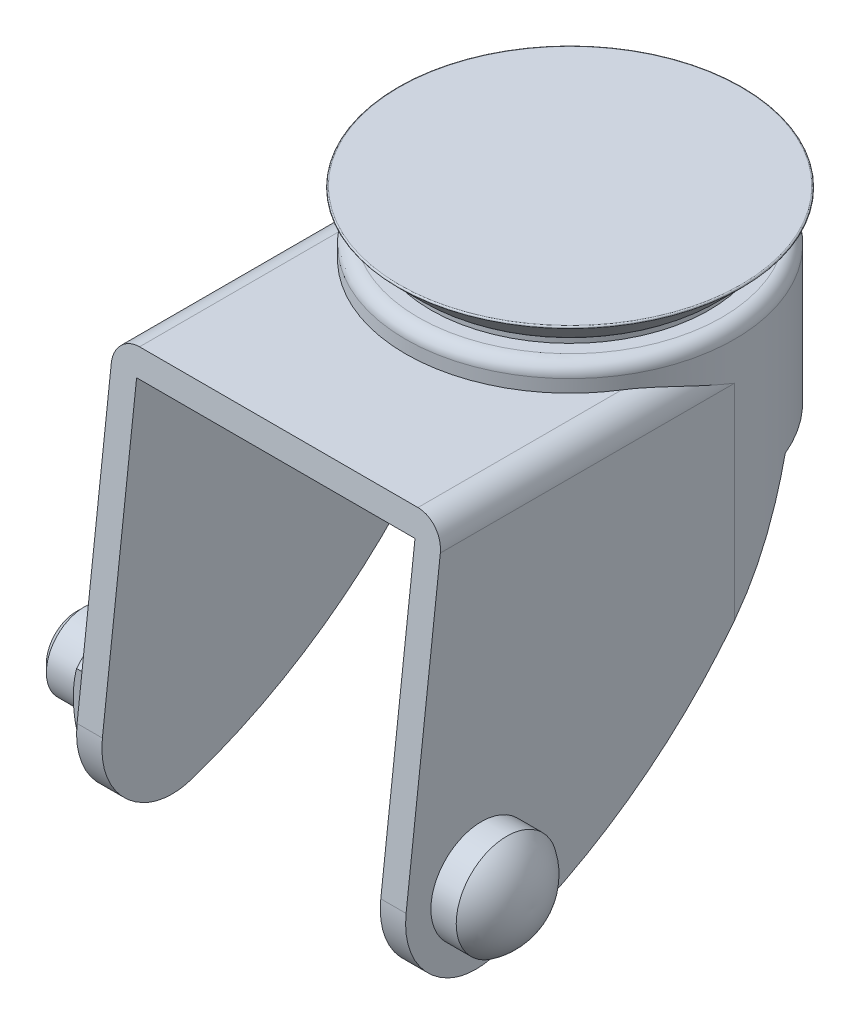
from build123d import *

# Parameters (mm, degrees)
EXTRUDE_1_DEPTH          = 60
SKETCH_3_W               = 22
SKETCH_3_H               = 51
CUT_EXTRUDE_1_DEPTH      = 70
CUT_EXTRUDE_START        = -51
SKETCH_4_R               = 11
CUT_EXTRUDE_2_DEPTH      = 51
CUT_EXTRUDE_3_DEPTH      = 200
CUT_EXTRUDE_3_DEPTH_BACK = 200
SKETCH_8_R               = 5.3
CUT_EXTRUDE_4_DEPTH      = 200


with BuildPart() as part:
    # 草图1 → 旋转1 (revolve)
    with BuildSketch(Plane.XY):
        with BuildLine():
            Line((0, 0), (11, 0))
            Line((11, 0), (11, -3))
            Line((11, -3), (12, -3))
            ThreePointArc((12, -3), (12.707106781, -3.292893219), (13, -4))
            Line((13, -4), (13, -51))
            Line((13, -51), (0, -51))
            Line((0, -51), (0, 0))
        make_face()
    revolve(axis=Axis((0, -51, 0), (0, 1, 0)))

    # 草图2 → 凸台-拉伸1 (add)
    with BuildSketch(Plane.XY):
        with BuildLine():
            Line((-13, -7), (-13, -56))
            Line((-13, -56), (13, -56))
            Line((13, -56), (13, -7))
            ThreePointArc((13, -7), (12.414213562, -5.585786438), (11, -5))
            Line((11, -5), (-11, -5))
            ThreePointArc((-11, -5), (-12.414213562, -5.585786438), (-13, -7))
        make_face()
    extrude(amount=EXTRUDE_1_DEPTH)

    # 草图3 → 切除-拉伸1 (cut)
    with BuildSketch(Plane.XY):
        with Locations((0, -32.5)):
            Rectangle(SKETCH_3_W, SKETCH_3_H)
    extrude(amount=CUT_EXTRUDE_1_DEPTH, mode=Mode.SUBTRACT)

    # 草图4 → 切除-拉伸2 (cut)
    with BuildSketch(Plane(origin=(0, -4, 0), x_dir=(1, 0, 0), z_dir=(0, 1, 0)).offset(CUT_EXTRUDE_START)):
        Circle(SKETCH_4_R)
    extrude(amount=CUT_EXTRUDE_2_DEPTH, mode=Mode.SUBTRACT)

    # 草图5 → 切除-拉伸3 (cut, two sides: drawn at the far end of the back side and taken through both)
    with BuildSketch(Plane(origin=(0, 0, 0), x_dir=(0, 0, -1), z_dir=(1, 0, 0)).offset(-CUT_EXTRUDE_3_DEPTH_BACK)):
        with BuildLine():
            Line((-150, -300), (150, -300))
            Line((150, -300), (150, -14.8))
            Line((150, -14.8), (5, -14.8))
            ThreePointArc((5, -14.8), (-4.621248551, -28.233362883), (-18.851090392, -36.631890327))
            ThreePointArc((-18.851090392, -36.631890327), (-20.797407313, -36.8816693), (-22.689958242, -36.363219617))
            ThreePointArc((-22.689958242, -36.363219617), (-25.279270083, -33.851194029), (-25.960007245, -30.308397776))
            Line((-25.960007245, -30.308397776), (-23, -4.8))
            Line((-23, -4.8), (-150, -4.8))
            Line((-150, -4.8), (-150, -300))
        make_face()
    extrude(amount=CUT_EXTRUDE_3_DEPTH + CUT_EXTRUDE_3_DEPTH_BACK, mode=Mode.SUBTRACT)

    # 草图6 → 旋转2 (revolve)
    with BuildSketch(Plane.XY.offset(20)):
        with BuildLine():
            Line((13, -31), (13, -27))
            Line((13, -27), (15, -27))
            ThreePointArc((15, -27), (16.53207252, -28.73396374), (17, -31))
            Line((17, -31), (13, -31))
        make_face()
    revolve(axis=Axis((17, -31, 20), (-1, 0, 0)))

    # 草图7 → 旋转3 (revolve)
    with BuildSketch(Plane.XY.offset(20)):
        with BuildLine():
            Line((-19, -31), (-19, -28.6135))
            Line((-19, -28.6135), (-18.3865, -28))
            Line((-18.3865, -28), (-16, -28))
            Line((-16, -28), (-16, -28.6))
            ThreePointArc((-16, -28.6), (-15.631562592, -27.345182253), (-15, -26.2))
            Line((-15, -26.2), (-13, -26.2))
            Line((-13, -26.2), (-13, -31))
            Line((-13, -31), (-19, -31))
        make_face()
    revolve(axis=Axis((-13, -31, 20), (-1, 0, 0)))

    # 草图8 → 切除-拉伸4 (cut)
    with BuildSketch(Plane(origin=(-13, 0, 0), x_dir=(0, 0, -1), z_dir=(1, 0, 0))):
        with Locations((-20, -31)):
            Circle(SKETCH_8_R)
        Polygon((-23.6, -33.078460969), (-20, -35.156921938), (-16.4, -33.078460969), (-16.4, -28.921539031), (-20, -26.843078062), (-23.6, -28.921539031), align=None, mode=Mode.SUBTRACT)
    extrude(amount=-CUT_EXTRUDE_4_DEPTH, mode=Mode.SUBTRACT)

    # 草图9 → 旋转4 (revolve)
    with BuildSketch(Plane.XY):
        with BuildLine():
            Line((0, 0), (13.508578644, 0))
            ThreePointArc((13.508578644, 0), (13.600966597, -0.061731657), (13.579289322, -0.170710678))
            Line((13.579289322, -0.170710678), (11.542893219, -2.207106781))
            ThreePointArc((11.542893219, -2.207106781), (11.21846987, -2.423879533), (10.835786438, -2.5))
            Line((10.835786438, -2.5), (0, -2.5))
            Line((0, -2.5), (0, 0))
        make_face()
    revolve(axis=Axis((0, -2.5, 0), (0, 1, 0)))


solid = part.part
